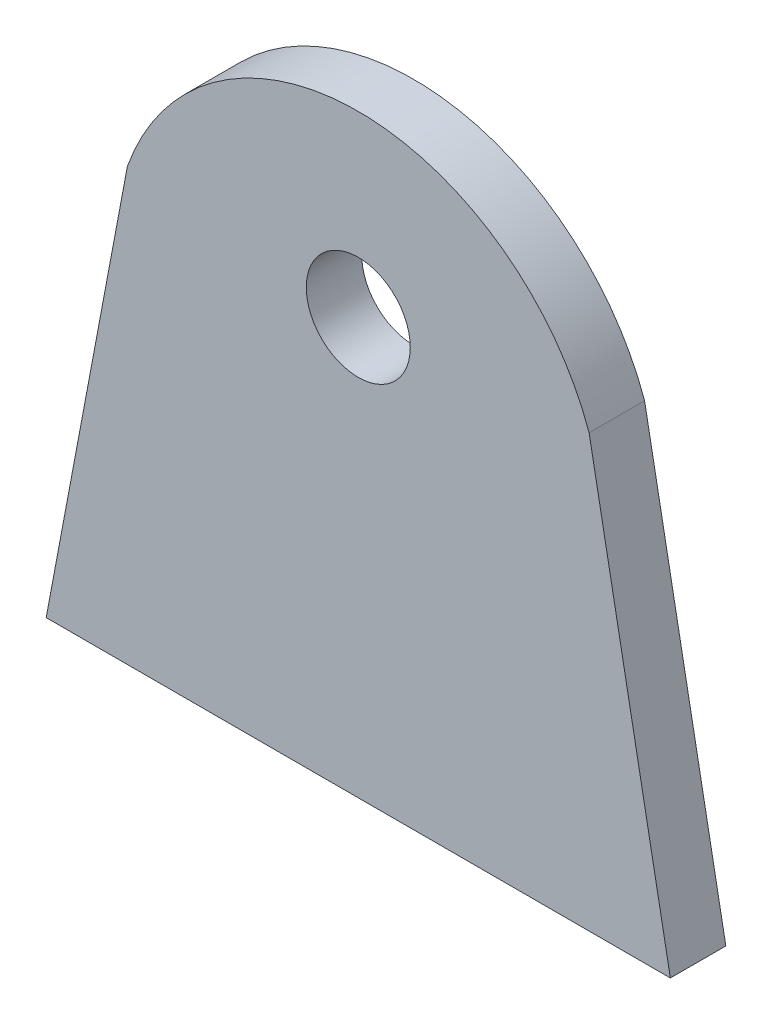
from build123d import *

# Parameters (mm, degrees)
SKETCH1_R           = 2.38125
BOSS_EXTRUDE1_DEPTH = 2.54


with BuildPart() as part:
    # Sketch1 → Boss-Extrude1 (new body)
    with BuildSketch(Plane.XY):
        with BuildLine():
            Line((0, 0), (28.575, 0))
            Line((28.575, 0), (24.855666251, 19.758430469))
            ThreePointArc((24.855666251, 19.758430469), (14.2875, 27.2161), (3.719333749, 19.758430469))
            Line((3.719333749, 19.758430469), (0, 0))
        make_face()
        with Locations((14.2875, 19.05)):
            Circle(SKETCH1_R, mode=Mode.SUBTRACT)
    extrude(amount=-BOSS_EXTRUDE1_DEPTH)


solid = part.part
